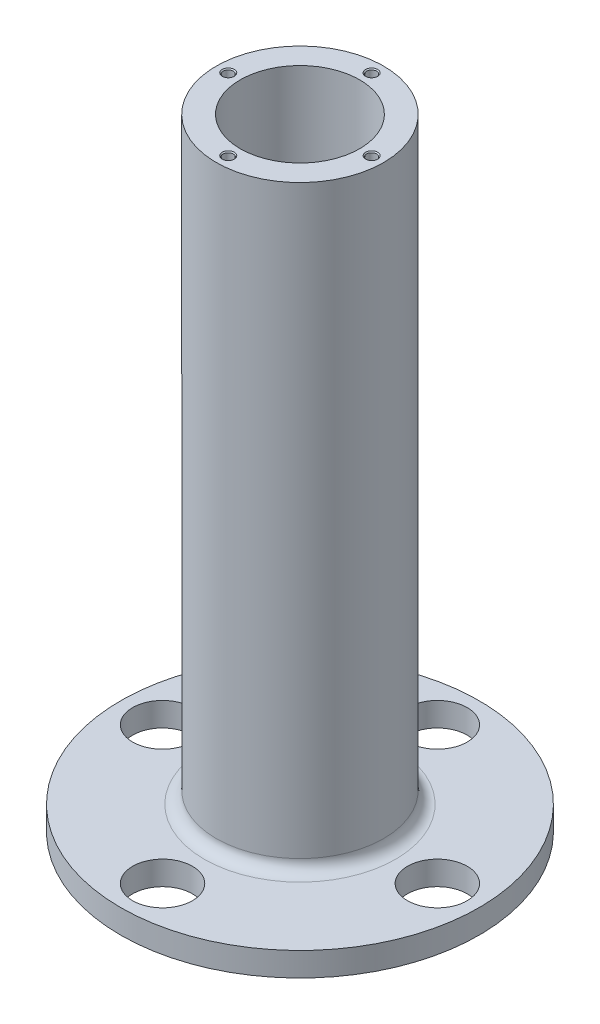
from build123d import *

# Parameters (mm, degrees)
SKETCH_1_R                   = 75
EXTRUDE_1_DEPTH              = 10
SKETCH_2_R                   = 35
SKETCH_2_R_2                 = 25
EXTRUDE_1_2_DEPTH            = 250
HOLE_WIZARD_1_D              = 25
HOLE_WIZARD_M5_1_D           = 4.2
HOLE_WIZARD_M5_1_DEPTH       = 22.4
HOLE_WIZARD_M5_1_CSINK_D     = 5.05
HOLE_WIZARD_M5_1_CSINK_ANGLE = 90
HOLE_WIZARD_M5_1_TIP         = 1.2618073
FILLET_1_R                   = 5


with BuildPart() as part:
    # 草图1 → Extrude 1 (new body)
    with BuildSketch(Plane(origin=(0, 0, 0), x_dir=(1, 0, 0), z_dir=(0, 1, 0))):
        with Locations(Location((0, 0, 0), (0, 0, 270))):
            Circle(SKETCH_1_R)
    extrude(amount=EXTRUDE_1_DEPTH)

    # 草图2 → Extrude 1 2 (add)
    with BuildSketch(Plane(origin=(0, 10, 0), x_dir=(1, 0, 0), z_dir=(0, 1, 0))):
        Circle(SKETCH_2_R)
        Circle(SKETCH_2_R_2, mode=Mode.SUBTRACT)
    extrude(amount=EXTRUDE_1_2_DEPTH)

    # 孔1 (through all)
    with Locations(Plane(origin=(0, 10, 0), x_dir=(1, 0, 0), z_dir=(0, 1, 0))):
        with Locations((0, 57.5), (57.5, 0), (0, -57.5), (-57.5, 0)):
            Hole(HOLE_WIZARD_1_D / 2)

    # M5 螺纹孔1
    with Locations(Plane(origin=(0, 260, 0), x_dir=(1, 0, 0), z_dir=(0, 1, 0))):
        with Locations((0, -30), (-30, 0), (0, 30), (30, 0)):
            CounterSinkHole(HOLE_WIZARD_M5_1_D / 2, HOLE_WIZARD_M5_1_CSINK_D / 2, depth=HOLE_WIZARD_M5_1_DEPTH, counter_sink_angle=HOLE_WIZARD_M5_1_CSINK_ANGLE)
            with Locations((0, 0, -(HOLE_WIZARD_M5_1_DEPTH + HOLE_WIZARD_M5_1_TIP / 2))):  # 118° drill point
                Cone(0, HOLE_WIZARD_M5_1_D / 2, HOLE_WIZARD_M5_1_TIP, mode=Mode.SUBTRACT)

    # 圆角1
    fillet_1_edges = [part.edges().sort_by_distance(p)[0] for p in [
        (-35, 10, 0),
    ]]
    fillet(fillet_1_edges, radius=FILLET_1_R)


solid = part.part
